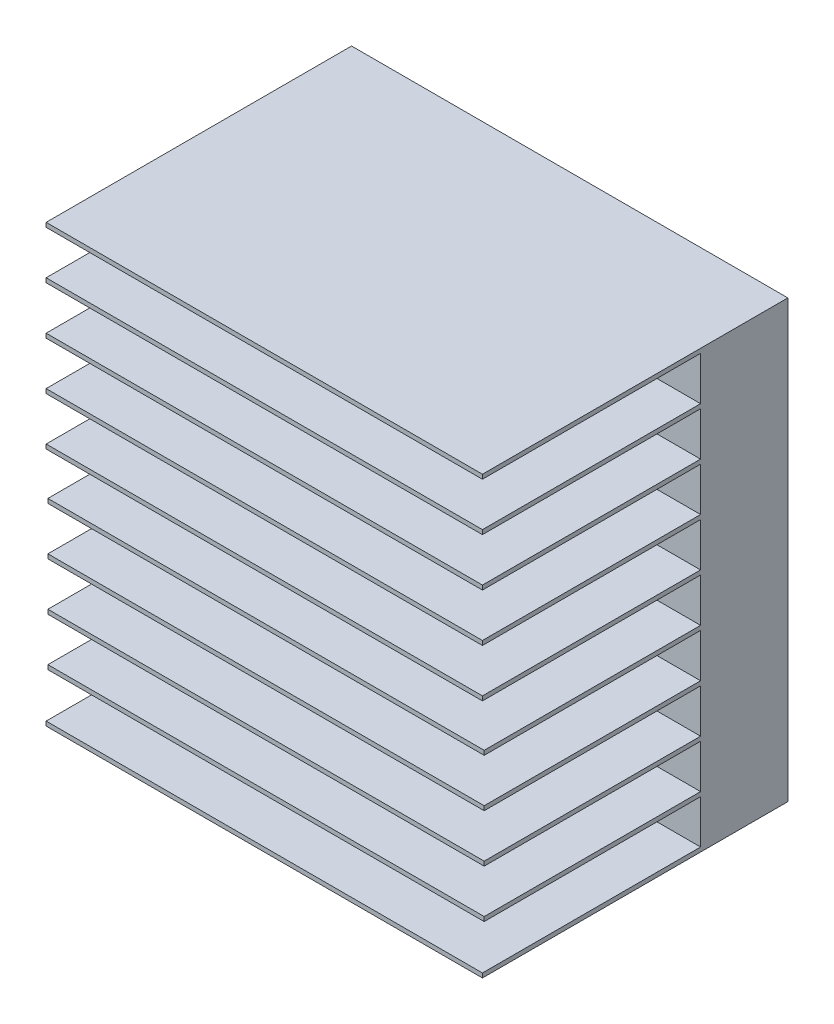
from build123d import *

# Parameters (mm, degrees)
SKETCH2_W           = 25.4
SKETCH2_H           = 25.4
BOSS_EXTRUDE1_DEPTH = 5.08
SKETCH3_W           = 25.4
SKETCH3_H           = 0.254
BOSS_EXTRUDE2_DEPTH = 12.7
SKETCH6_W           = 25.4
SKETCH6_H           = 0.254
BOSS_EXTRUDE3_DEPTH = 12.5984
SKETCH5_W           = 25.4
SKETCH5_H           = 0.254
BOSS_EXTRUDE4_DEPTH = 12.7
SKETCH4_W           = 25.4
SKETCH4_H           = 0.254
BOSS_EXTRUDE5_DEPTH = 12.7


with BuildPart() as part:
    # Sketch2 → Boss-Extrude1 (new body)
    with BuildSketch(Plane.XY):
        with Locations((12.7, 12.7)):
            Rectangle(SKETCH2_W, SKETCH2_H)
    extrude(amount=BOSS_EXTRUDE1_DEPTH)

    # Sketch3 → Boss-Extrude2 (add)
    with BuildSketch(Plane.XY.offset(5.08)):
        with Locations((12.7, 25.273)):
            Rectangle(SKETCH3_W, SKETCH3_H)
    extrude(amount=BOSS_EXTRUDE2_DEPTH)

    # Sketch6 → Boss-Extrude3 (add)
    with BuildSketch(Plane.XY.offset(5.08)):
        with Locations((12.7, 11.303)):
            Rectangle(SKETCH6_W, SKETCH6_H)
        with Locations((12.7, 8.509)):
            Rectangle(SKETCH6_W, SKETCH6_H)
        with Locations((12.7, 5.715)):
            Rectangle(SKETCH6_W, SKETCH6_H)
        with Locations((12.7, 2.921)):
            Rectangle(SKETCH6_W, SKETCH6_H)
    extrude(amount=BOSS_EXTRUDE3_DEPTH)

    # Sketch5 → Boss-Extrude4 (add)
    with BuildSketch(Plane.XY.offset(5.08)):
        with Locations((12.7, 19.685)):
            Rectangle(SKETCH5_W, SKETCH5_H)
        with Locations((12.7, 16.891)):
            Rectangle(SKETCH5_W, SKETCH5_H)
        with Locations((12.7, 14.097)):
            Rectangle(SKETCH5_W, SKETCH5_H)
    extrude(amount=BOSS_EXTRUDE4_DEPTH)

    # Sketch4 → Boss-Extrude5 (add)
    with BuildSketch(Plane.XY.offset(5.08)):
        with Locations((12.7, 0.127)):
            Rectangle(SKETCH4_W, SKETCH4_H)
        with Locations((12.7, 22.479)):
            Rectangle(SKETCH4_W, SKETCH4_H)
    extrude(amount=BOSS_EXTRUDE5_DEPTH)


solid = part.part
